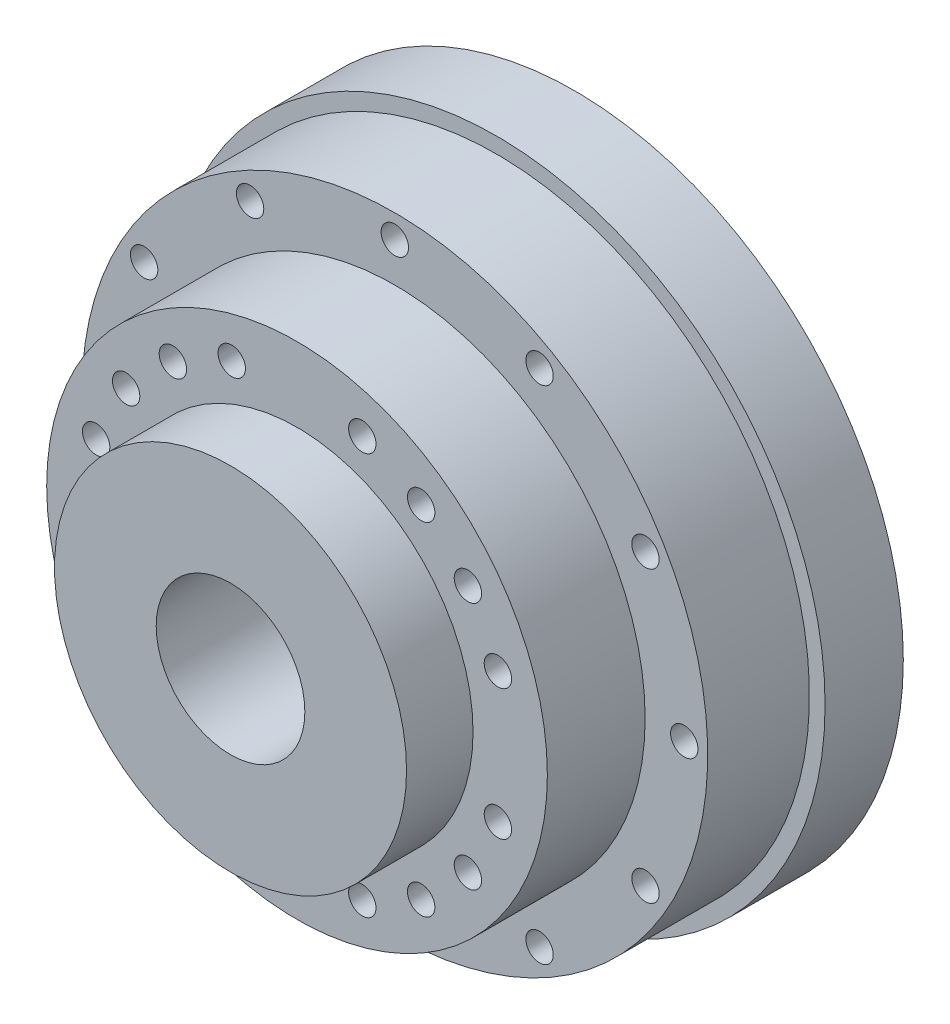
from build123d import *

# Parameters (mm, degrees)
SKETCH_1_R               = 42
EXTRUDE_1_DEPTH          = 10
SKETCH_2_R               = 40
EXTRUDE_2_DEPTH          = 13
SKETCH_3_R               = 32
EXTRUDE_3_DEPTH          = 12.5
SKETCH_4_R               = 22.5
EXTRUDE_4_DEPTH          = 8.5
EXTRUDE_START            = 5.5
SKETCH_5_R               = 22.5
EXTRUDE_5_DEPTH          = 5.5
SKETCH_6_R               = 12.5
EXTRUDE_6_DEPTH          = 7
SKETCH_7_R               = 9.5
CUT_EXTRUDE_1_DEPTH      = 56.5
SKETCH_8_R               = 1.75
CUT_EXTRUDE_2_DEPTH      = 23
SKETCH_9_R               = 1.75
CUT_EXTRUDE_3_DEPTH      = 12
CUT_EXTRUDE_4_REACH      = 83.672
CUT_EXTRUDE_4_END_RADIUS = 9.5
SKETCH_11_R              = 1.5
PATTERN_CIRCULAR_1_COUNT = 3


with BuildPart() as part:
    # Эскиз1 → Бобышка-Вытянуть1 (new body)
    with BuildSketch(Plane.XY):
        Circle(SKETCH_1_R)
    extrude(amount=EXTRUDE_1_DEPTH)

    # Эскиз2 → Бобышка-Вытянуть2 (add)
    with BuildSketch(Plane.XY.offset(10)):
        with Locations(Location((0, 0, 0), (0, 0, 180))):
            Circle(SKETCH_2_R)
    extrude(amount=EXTRUDE_2_DEPTH)

    # Эскиз3 → Бобышка-Вытянуть3 (add)
    with BuildSketch(Plane.XY.offset(23)):
        Circle(SKETCH_3_R)
    extrude(amount=EXTRUDE_3_DEPTH)

    # Эскиз4 → Бобышка-Вытянуть4 (add)
    with BuildSketch(Plane.XY.offset(35.5)):
        Circle(SKETCH_4_R)
    extrude(amount=EXTRUDE_4_DEPTH)

    # Эскиз5 → Бобышка-Вытянуть5 (add)
    with BuildSketch(Plane(origin=(0, 0, 0), x_dir=(-1, 0, 0), z_dir=(0, 0, -1)).offset(EXTRUDE_START)):
        with Locations(Location((0, 0, 0), (0, 0, 180))):
            Circle(SKETCH_5_R)
    extrude(amount=-EXTRUDE_5_DEPTH)

    # Эскиз6 → Бобышка-Вытянуть6 (add)
    with BuildSketch(Plane(origin=(0, 0, -5.5), x_dir=(-1, 0, 0), z_dir=(0, 0, -1))):
        Circle(SKETCH_6_R)
    extrude(amount=EXTRUDE_6_DEPTH)

    # Эскиз7 → Вырез-Вытянуть1 (cut)
    with BuildSketch(Plane(origin=(0, 0, -12.5), x_dir=(-1, 0, 0), z_dir=(0, 0, -1))):
        Circle(SKETCH_7_R)
    extrude(amount=-CUT_EXTRUDE_1_DEPTH, mode=Mode.SUBTRACT)

    # Эскиз8 → Вырез-Вытянуть2 (cut)
    with BuildSketch(Plane.XY.offset(23)):
        with Locations((0, 37)):
            Circle(SKETCH_8_R)
        with Locations((18.5, 32.04293994)):
            Circle(SKETCH_8_R)
        with Locations((32.04293994, 18.5)):
            Circle(SKETCH_8_R)
        with Locations((37, 0)):
            Circle(SKETCH_8_R)
        with Locations((32.04293994, -18.5)):
            Circle(SKETCH_8_R)
        with Locations((18.5, -32.04293994)):
            Circle(SKETCH_8_R)
        with Locations((0, -37)):
            Circle(SKETCH_8_R)
        with Locations((-18.5, -32.04293994)):
            Circle(SKETCH_8_R)
        with Locations((-32.04293994, -18.5)):
            Circle(SKETCH_8_R)
        with Locations((-37, 0)):
            Circle(SKETCH_8_R)
        with Locations((-32.04293994, 18.5)):
            Circle(SKETCH_8_R)
        with Locations((-18.5, 32.04293994)):
            Circle(SKETCH_8_R)
    extrude(amount=-CUT_EXTRUDE_2_DEPTH, mode=Mode.SUBTRACT)

    # Эскиз9 → Вырез-Вытянуть3 (cut)
    with BuildSketch(Plane.XY.offset(35.5)):
        with Locations((-8.343458848, 25.67852594)):
            Circle(SKETCH_9_R)
        with Locations((8.343458848, 25.67852594)):
            Circle(SKETCH_9_R)
        with Locations((15.870201812, 21.843458848)):
            Circle(SKETCH_9_R)
        with Locations((21.843458848, 15.870201812)):
            Circle(SKETCH_9_R)
        with Locations((25.67852594, 8.343458848)):
            Circle(SKETCH_9_R)
        with Locations((25.67852594, -8.343458848)):
            Circle(SKETCH_9_R)
        with Locations((21.843458848, -15.870201812)):
            Circle(SKETCH_9_R)
        with Locations((15.870201812, -21.843458848)):
            Circle(SKETCH_9_R)
        with Locations((8.343458848, -25.67852594)):
            Circle(SKETCH_9_R)
        with Locations((-8.343458848, -25.67852594)):
            Circle(SKETCH_9_R)
        with Locations((-15.870201812, -21.843458848)):
            Circle(SKETCH_9_R)
        with Locations((-21.843458848, -15.870201812)):
            Circle(SKETCH_9_R)
        with Locations((-25.67852594, -8.343458848)):
            Circle(SKETCH_9_R)
        with Locations((-25.67852594, 8.343458848)):
            Circle(SKETCH_9_R)
        with Locations((-21.843458848, 15.870201812)):
            Circle(SKETCH_9_R)
        with Locations((-15.870201812, 21.843458848)):
            Circle(SKETCH_9_R)
    extrude(amount=-CUT_EXTRUDE_3_DEPTH, mode=Mode.SUBTRACT)

    # Вырез-Вытянуть4: up to this cylinder (the profile starts outside it)
    cut_extrude_4_end = Plane(origin=(0, 0, -10), z_dir=(0, 0, -1)) * Cylinder(CUT_EXTRUDE_4_END_RADIUS, 187.344, mode=Mode.PRIVATE)
    # Эскиз11 → Вырез-Вытянуть4 (cut, up to the surface)
    with BuildSketch(Plane(origin=(0, 12.5, 0), x_dir=(1, 0, 0), z_dir=(0, 1, 0)), mode=Mode.PRIVATE) as cut_extrude_4_sk1:
        with Locations(Location((0, 10, 0), (0, 0, 270))):
            Circle(SKETCH_11_R)
    cut_extrude_4_tool1 = extrude(cut_extrude_4_sk1.sketch, amount=-CUT_EXTRUDE_4_REACH, mode=Mode.PRIVATE) - cut_extrude_4_end
    cut_extrude_4 = cut_extrude_4_tool1.solids().sort_by_distance((0, 12.5, -10))[0]
    add(cut_extrude_4, mode=Mode.SUBTRACT)

    # Круговой массив1: Вырез-Вытянуть4 ×3 about axis
    pattern_circular_1_axis = Axis((0, 0, 70.870057685), (0, 0, -1))
    for i in range(1, PATTERN_CIRCULAR_1_COUNT):
        add(cut_extrude_4.rotate(pattern_circular_1_axis, i * 360 / PATTERN_CIRCULAR_1_COUNT), mode=Mode.SUBTRACT)


solid = part.part
